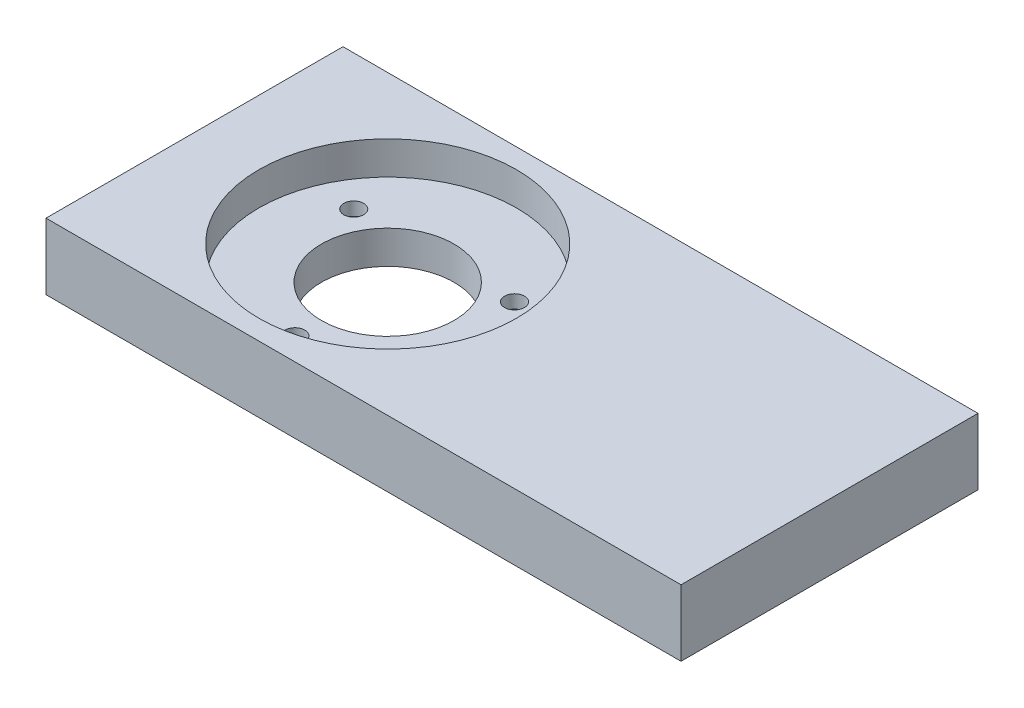
from build123d import *

# Parameters (mm, degrees)
ENCODERSIDEWALLSKETCH_W    = 95.8
ENCODERSIDEWALLSKETCH_H    = 44.8
BOSS_EXTRUDE1_DEPTH        = 10
SKETCH2_R                  = 10
ENCODERAXLECUT_DEPTH       = 10
ENCODERFULLHOLE_R          = 19.425
ENCODERFULLHOLEBORE_DEPTH  = 5
ENCODERSCREWLAYOUTSKETCH_R = 1.5
ENCODERSCREWLAYOUT_DEPTH   = 62.184071257
SKETCH6_R                  = 3
CUT_EXTRUDE4_DEPTH         = 3


with BuildPart() as part:
    # EncoderSideWallSketch → Boss-Extrude1 (new body)
    with BuildSketch(Plane(origin=(0, 0, 0), x_dir=(1, 0, 0), z_dir=(0, 1, 0))):
        with Locations((8.673150268, 0.358937681)):
            Rectangle(ENCODERSIDEWALLSKETCH_W, ENCODERSIDEWALLSKETCH_H)
    extrude(amount=BOSS_EXTRUDE1_DEPTH)

    # Sketch2 → EncoderAxleCut (cut)
    with BuildSketch(Plane(origin=(0, 10, 0), x_dir=(1, 0, 0), z_dir=(0, 1, 0))):
        with Locations(Location((-10.076849732, 0.358937681, 0), (0, 0, 270))):
            Circle(SKETCH2_R)
    extrude(amount=-ENCODERAXLECUT_DEPTH, mode=Mode.SUBTRACT)

    # EncoderFullHole → EncoderFullHoleBore (cut)
    with BuildSketch(Plane(origin=(0, 10, 0), x_dir=(1, 0, 0), z_dir=(0, 1, 0))):
        with Locations(Location((-10.076849732, 0.358937681, 0), (0, 0, 270))):
            Circle(ENCODERFULLHOLE_R)
    extrude(amount=-ENCODERFULLHOLEBORE_DEPTH, mode=Mode.SUBTRACT)

    # EncoderScrewLayoutSketch → EncoderScrewLayout (cut, through all)
    with BuildSketch(Plane(origin=(0, 5, 0), x_dir=(1, 0, 0), z_dir=(0, 1, 0))):
        with Locations(Location((-22.201849732, 7.359309695, 0), (0, 0, 270))):
            Circle(ENCODERSCREWLAYOUTSKETCH_R)
        with Locations(Location((2.048150268, 7.359309695, 0), (0, 0, 270))):
            Circle(ENCODERSCREWLAYOUTSKETCH_R)
        with Locations(Location((-10.076849732, -13.641806347, 0), (0, 0, 270))):
            Circle(ENCODERSCREWLAYOUTSKETCH_R)
    extrude(amount=-ENCODERSCREWLAYOUT_DEPTH, mode=Mode.SUBTRACT)

    # Sketch6 → Cut-Extrude4 (cut)
    with BuildSketch(Plane.XZ):
        with Locations(Location((-10.076849732, 13.641806347, 0), (0, 0, 270))):
            Circle(SKETCH6_R)
        with Locations(Location((-22.201849732, -7.359309695, 0), (0, 0, 270))):
            Circle(SKETCH6_R)
        with Locations(Location((2.048150268, -7.359309695, 0), (0, 0, 270))):
            Circle(SKETCH6_R)
    extrude(amount=-CUT_EXTRUDE4_DEPTH, mode=Mode.SUBTRACT)


solid = part.part
